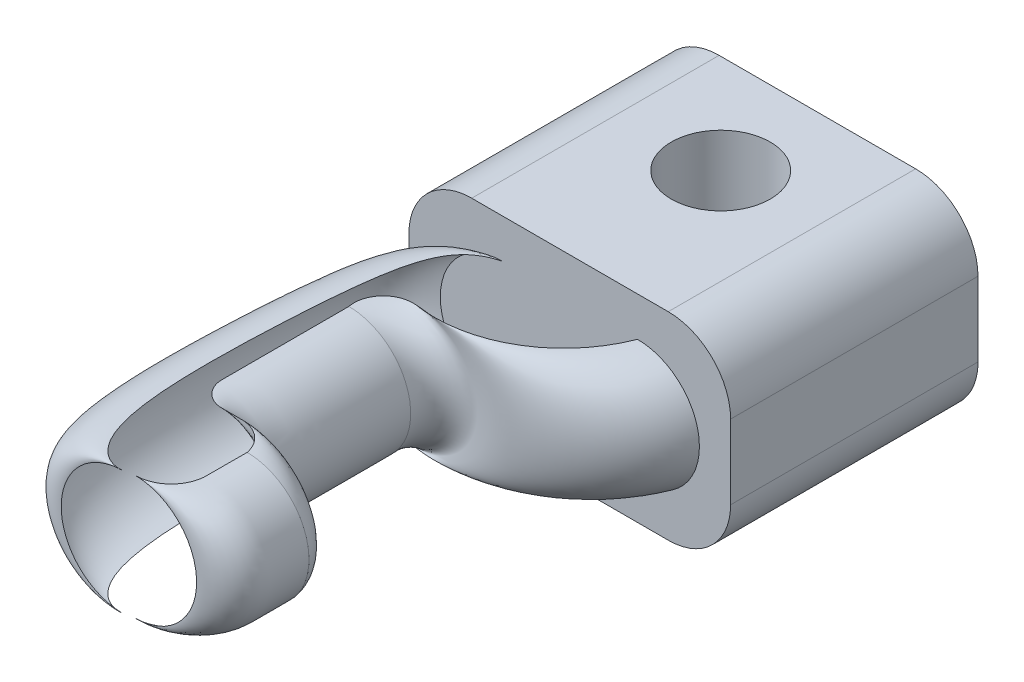
from build123d import *

# Parameters (mm, degrees)
BOSS_EXTRU_1_START      = 80
BOSS_EXTRU_1_DEPTH      = 100
ENL_V_START             = -80
ESQUISSE3_W             = 100
ESQUISSE3_H             = 16
ENL_V_MAT_EXTRU_1_DEPTH = 80
CONG_4_R                = 11
ESQUISSE4_R             = 20
ENL_V_MAT_EXTRU_2_DEPTH = 131.989866835


with BuildPart() as part:
    # Esquisse1 → Boss.-Extru.1 (new body)
    with BuildSketch(Plane.XY.offset(BOSS_EXTRU_1_START)):
        with BuildLine():
            Line((38.785545077, 40.614050057), (-40.651735145, 40.614050057))
            add(Edge.make_bspline(
                [(-40.651735145, 40.614050057), (-42.314401042, 40.614050057), (-43.949970441, 40.454492538), (-46.364281177, 39.985249726), (-47.162496652, 39.790237743), (-48.745517159, 39.321246489), (-49.533460665, 39.045648859), (-51.828661424, 38.115479858), (-53.281442172, 37.355862098), (-55.345438246, 36.008719052), (-56.014108587, 35.524812991), (-57.311227091, 34.484460801), (-57.928932966, 33.936606502), (-59.691288641, 32.213512357), (-60.746535217, 30.959092716), (-62.145716067, 28.915215354), (-62.582595679, 28.203507769), (-63.374918425, 26.755312757), (-63.732785576, 26.015863677), (-64.373256555, 24.506793589), (-64.65585931, 23.737172152), (-65.144921869, 22.167404719), (-65.351725199, 21.365590427), (-65.850986238, 18.923189743), (-66.017764036, 17.277412601), (-66.017764036, 15.614050057)],
                knots=[0, 0, 0, 0, 0.125, 0.125, 0.1875, 0.1875, 0.25, 0.25, 0.375, 0.375, 0.4375, 0.4375, 0.5, 0.5, 0.625, 0.625, 0.6875, 0.6875, 0.75, 0.75, 0.8125, 0.8125, 0.875, 0.875, 1, 1, 1, 1], degree=3))
            Line((-66.017764036, 15.614050057), (-66.017764036, -14.385949943))
            add(Edge.make_bspline(
                [(-66.017764036, -14.385949943), (-66.017764036, -16.048876138), (-65.851094207, -17.683331778), (-65.361702976, -20.094123219), (-65.158373409, -20.890853543), (-64.669502924, -22.47027084), (-64.382985964, -23.253871687), (-63.418861279, -25.531148199), (-62.632909001, -26.969986123), (-61.47342948, -28.670438694), (-61.23260127, -29.005579947), (-60.732801819, -29.665809665), (-60.473222797, -29.991558275), (-59.675187681, -30.943569432), (-59.115575096, -31.547471943), (-57.356561849, -33.269755718), (-56.077742546, -34.299557378), (-54.343422936, -35.435349924), (-53.989857778, -35.654684562), (-53.276724993, -36.073359456), (-52.916218587, -36.273332214), (-51.823086229, -36.845648188), (-50.334662142, -37.535258588), (-48.785246215, -38.079902579), (-47.20487869, -38.550980299), (-46.395575711, -38.750272405), (-43.957668722, -39.226451984), (-42.313993676, -39.385949943), (-40.651735145, -39.385949943)],
                knots=[0, 0, 0, 0, 0.125, 0.125, 0.1875, 0.1875, 0.25, 0.25, 0.375, 0.375, 0.40625, 0.40625, 0.4375, 0.4375, 0.5, 0.5, 0.625, 0.625, 0.65625, 0.65625, 0.6875, 0.6875, 0.75, 0.8125, 0.8125, 0.875, 0.875, 1, 1, 1, 1], degree=3))
            Line((-40.651735145, -39.385949943), (38.785545077, -39.385949943))
            add(Edge.make_bspline(
                [(38.785545077, -39.385949943), (40.442664026, -39.385949943), (42.072477718, -39.225354876), (44.477877986, -38.753201256), (45.273076472, -38.556989578), (46.849967737, -38.085132809), (47.634388323, -37.807976207), (49.917807144, -36.873298226), (51.362544447, -36.110292076), (53.414281907, -34.757655279), (54.079899229, -34.270978942), (55.366402243, -33.228584654), (55.97873177, -32.679974918), (57.725866743, -30.954489737), (58.771668074, -29.698711403), (60.157750527, -27.653150155), (60.589614996, -26.942198814), (61.372344654, -25.496840481), (62.079494348, -24.020824341), (62.637956251, -22.484495371), (63.121147278, -20.91763397), (63.325643893, -20.116192861), (63.817740886, -17.683150497), (63.982235964, -16.043440912), (63.982235964, -14.385949943)],
                knots=[0, 0, 0, 0, 0.125, 0.125, 0.1875, 0.1875, 0.25, 0.25, 0.375, 0.375, 0.4375, 0.4375, 0.5, 0.5, 0.625, 0.625, 0.6875, 0.6875, 0.75, 0.8125, 0.8125, 0.875, 0.875, 1, 1, 1, 1], degree=3))
            Line((63.982235964, -14.385949943), (63.982235964, 15.614050057))
            add(Edge.make_bspline(
                [(63.982235964, 15.614050057), (63.982235964, 17.271310828), (63.817806647, 18.900524173), (63.334809815, 21.304028451), (63.134123418, 22.098426882), (62.65157662, 23.673377539), (62.368548411, 24.455463484), (61.415616974, 26.729252988), (60.63846114, 28.166500735), (59.491466105, 29.865784629), (59.253210251, 30.200733657), (58.758705823, 30.860661599), (58.501710157, 31.186502863), (57.710451504, 32.140097193), (57.155472753, 32.745084226), (55.410698291, 34.47070563), (54.141818247, 35.502843902), (52.420489637, 36.641694741), (52.068783545, 36.862138502), (51.359150828, 37.2830162), (51.00041085, 37.484029901), (49.912631681, 38.059303906), (48.431489045, 38.75242056), (46.889689036, 39.299828689), (45.317129339, 39.773347224), (44.511672713, 39.973796439), (42.081029739, 40.453478808), (40.442443449, 40.614050057), (38.785545077, 40.614050057)],
                knots=[0, 0, 0, 0, 0.125, 0.125, 0.1875, 0.1875, 0.25, 0.25, 0.375, 0.375, 0.40625, 0.40625, 0.4375, 0.4375, 0.5, 0.5, 0.625, 0.625, 0.65625, 0.65625, 0.6875, 0.6875, 0.75, 0.8125, 0.8125, 0.875, 0.875, 1, 1, 1, 1], degree=3))
        make_face()
    extrude(amount=-BOSS_EXTRU_1_DEPTH)

    # Esquisse3 → Enlèv. mat.-Extru.1 (cut)
    with BuildSketch(Plane(origin=(0, 0, -20), x_dir=(-1, 0, 0), z_dir=(0, 0, -1)).offset(ENL_V_START)):
        with Locations((0.484895913, -0.273885368)):
            Rectangle(ESQUISSE3_W, ESQUISSE3_H)
    extrude(amount=ENL_V_MAT_EXTRU_1_DEPTH, mode=Mode.SUBTRACT)

    # Congé4
    cong_4_edges = [part.edges().sort_by_distance(p)[0] for p in [
        (49.515104087, -0.273885368, 60),
        (-50.484895913, -0.273885368, 60),
    ]]
    fillet(cong_4_edges, radius=CONG_4_R)

    # Esquisse4 → Enlèv. mat.-Extru.2 (cut, through all)
    with BuildSketch(Plane.XZ.offset(39.385949943)):
        with Locations((0, 20)):
            Circle(ESQUISSE4_R)
    extrude(amount=-ENL_V_MAT_EXTRU_2_DEPTH, mode=Mode.SUBTRACT)


solid = part.part
